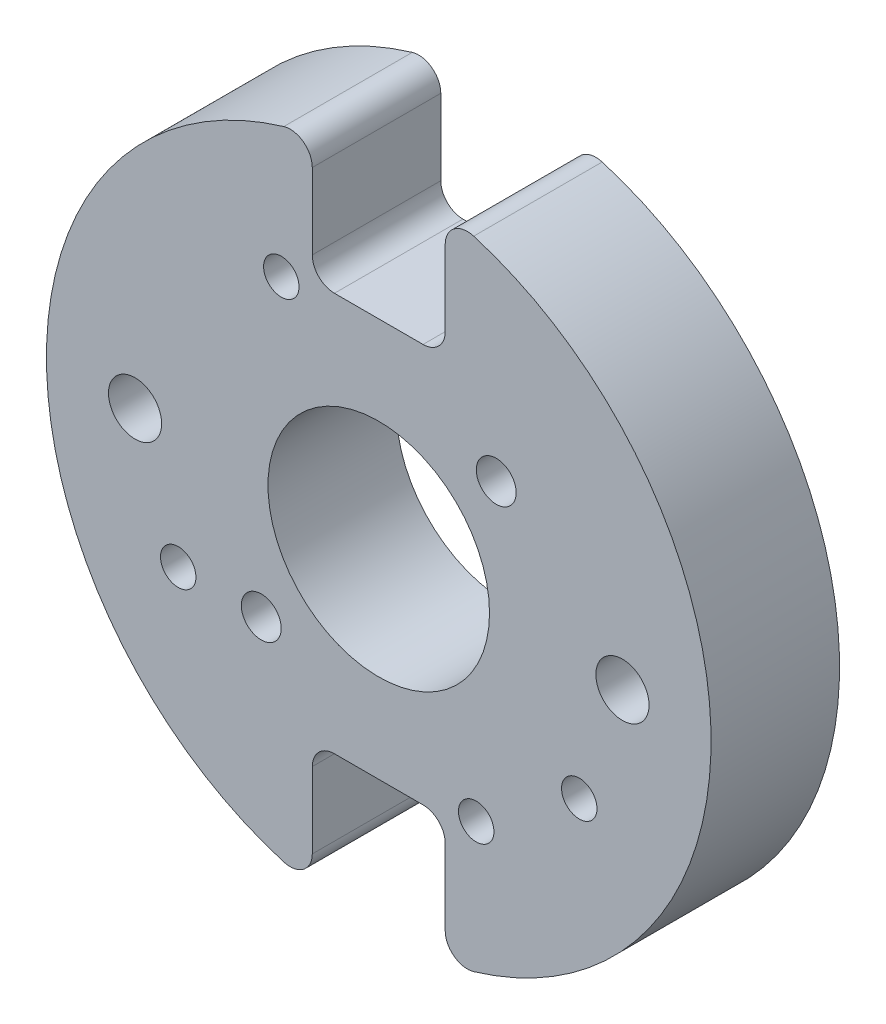
from build123d import *

# Parameters (mm, degrees)
SKETCH1_R                  = 15
SKETCH1_R_2                = 5
BOSS_EXTRUDE1_DEPTH        = 5.8
M2_CLEARANCE_HOLE1_D       = 2.4
M2_CLEARANCE_HOLE1_DEPTH   = 25.4
M2_CLEARANCE_HOLE1_TIP     = 0.721032743
M1_6_CLEARANCE_HOLE1_D     = 1.8
M1_6_CLEARANCE_HOLE1_DEPTH = 25.4
M1_6_CLEARANCE_HOLE1_TIP   = 0.540774557
SKETCH8_W                  = 6
SKETCH8_H                  = 6
CUT_EXTRUDE1_DEPTH         = 22.99181666
FILLET1_R                  = 1
M2X0_4_TAPPED_HOLE1_D      = 1.6
M2X0_4_TAPPED_HOLE1_DEPTH  = 5.99948
M2X0_4_TAPPED_HOLE1_TIP    = 0.480688495
M2X0_4_TAPPED_HOLE2_D      = 1.6
M2X0_4_TAPPED_HOLE2_DEPTH  = 5.99948
M2X0_4_TAPPED_HOLE2_TIP    = 0.480688495


with BuildPart() as part:
    # Sketch1 → Boss-Extrude1 (new body)
    with BuildSketch(Plane.XY):
        Circle(SKETCH1_R)
        Circle(SKETCH1_R_2, mode=Mode.SUBTRACT)
    extrude(amount=BOSS_EXTRUDE1_DEPTH)

    # M2 Clearance Hole1
    with Locations(Plane.XY.offset(5.8)):
        with Locations((-11, 0), (11, 0)):
            Hole(M2_CLEARANCE_HOLE1_D / 2, depth=M2_CLEARANCE_HOLE1_DEPTH)
            with Locations((0, 0, -(M2_CLEARANCE_HOLE1_DEPTH + M2_CLEARANCE_HOLE1_TIP / 2))):  # 118° drill point
                Cone(0, M2_CLEARANCE_HOLE1_D / 2, M2_CLEARANCE_HOLE1_TIP, mode=Mode.SUBTRACT)

    # M1.6 Clearance Hole1
    with Locations(Plane.XY.offset(5.8)):
        with Locations((5.303300859, 5.303300859), (-5.303300859, -5.303300859)):
            Hole(M1_6_CLEARANCE_HOLE1_D / 2, depth=M1_6_CLEARANCE_HOLE1_DEPTH)
            with Locations((0, 0, -(M1_6_CLEARANCE_HOLE1_DEPTH + M1_6_CLEARANCE_HOLE1_TIP / 2))):  # 118° drill point
                Cone(0, M1_6_CLEARANCE_HOLE1_D / 2, M1_6_CLEARANCE_HOLE1_TIP, mode=Mode.SUBTRACT)

    # Sketch8 → Cut-Extrude1 (cut, through all)
    with BuildSketch(Plane.XY.offset(5.8)):
        with Locations((0, -12)):
            Rectangle(SKETCH8_W, SKETCH8_H)
        with Locations((0, 12)):
            Rectangle(SKETCH8_W, SKETCH8_H)
    extrude(amount=-CUT_EXTRUDE1_DEPTH, mode=Mode.SUBTRACT)

    # Fillet1
    fillet1_edges = [part.edges().sort_by_distance(p)[0] for p in [
        (-3, -14.696938457, 2.9),
        (3, -14.696938457, 2.9),
        (3, -9, 2.9),
        (-3, -9, 2.9),
        (-3, 14.696938457, 2.9),
        (3, 14.696938457, 2.9),
        (-3, 9, 2.9),
        (3, 9, 2.9),
    ]]
    fillet(fillet1_edges, radius=FILLET1_R)

    # M2x0.4 Tapped Hole1
    with Locations(Plane.XY.offset(5.8)):
        with Locations((-4.398155541, 8.448778186), (4.398155541, -8.448778186)):
            Hole(M2X0_4_TAPPED_HOLE1_D / 2, depth=M2X0_4_TAPPED_HOLE1_DEPTH)
            with Locations((0, 0, -(M2X0_4_TAPPED_HOLE1_DEPTH + M2X0_4_TAPPED_HOLE1_TIP / 2))):  # 118° drill point
                Cone(0, M2X0_4_TAPPED_HOLE1_D / 2, M2X0_4_TAPPED_HOLE1_TIP, mode=Mode.SUBTRACT)

    # M2x0.4 Tapped Hole2
    with Locations(Plane(origin=(0, 0, 0), x_dir=(-1, 0, 0), z_dir=(0, 0, -1))):
        with Locations((9.051784123, -5.22605), (-9.051784123, -5.22605), (0, 10.4521)):
            Hole(M2X0_4_TAPPED_HOLE2_D / 2, depth=M2X0_4_TAPPED_HOLE2_DEPTH)
            with Locations((0, 0, -(M2X0_4_TAPPED_HOLE2_DEPTH + M2X0_4_TAPPED_HOLE2_TIP / 2))):  # 118° drill point
                Cone(0, M2X0_4_TAPPED_HOLE2_D / 2, M2X0_4_TAPPED_HOLE2_TIP, mode=Mode.SUBTRACT)


solid = part.part
